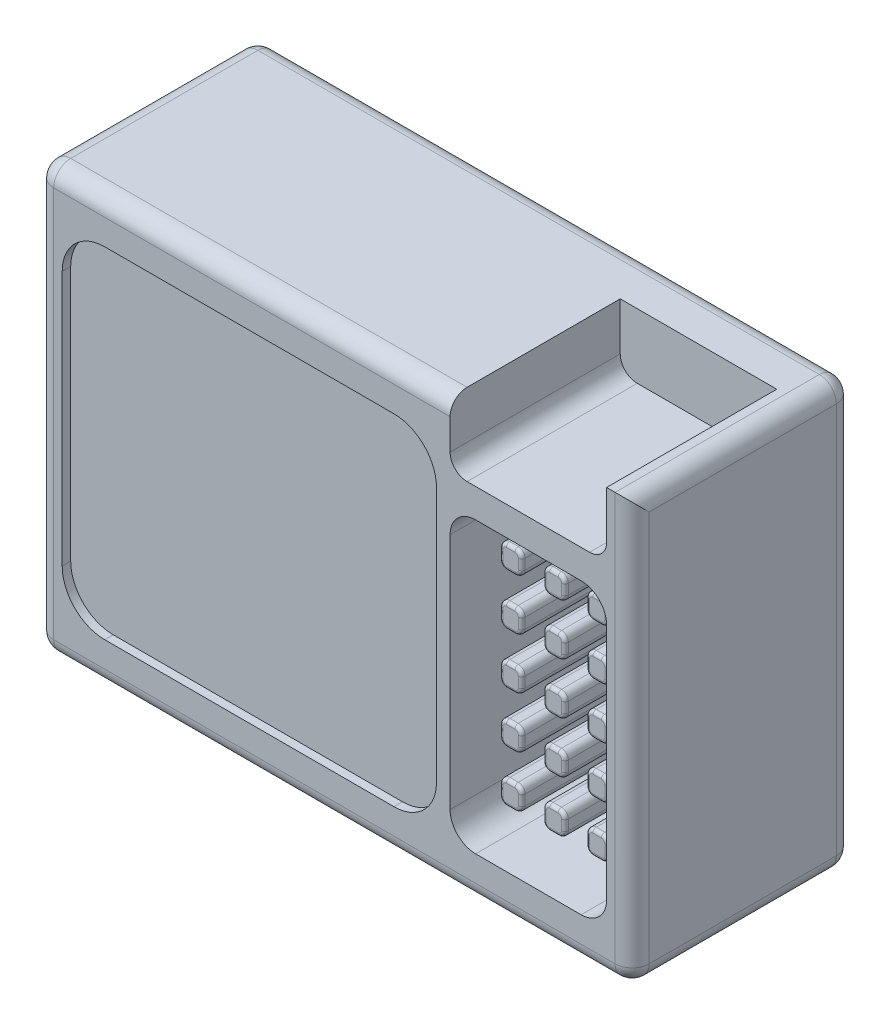
from build123d import *

# Parameters (mm, degrees)
SKETCH1_W           = 35
SKETCH1_H           = 25
BOSS_EXTRUDE1_DEPTH = 13
CUT_EXTRUDE1_DEPTH  = 0.5
CUT_EXTRUDE2_DEPTH  = 10
CUT_EXTRUDE3_DEPTH  = 1.5
FILLET1_R           = 1
FILLET3_R           = 0.2


with BuildPart() as part:
    # Sketch1 → Boss-Extrude1 (new body)
    with BuildSketch(Plane.XY):
        Rectangle(SKETCH1_W, SKETCH1_H)
    extrude(amount=BOSS_EXTRUDE1_DEPTH)

    # Sketch2 → Cut-Extrude1 (cut)
    with BuildSketch(Plane.XY.offset(13)):
        with BuildLine():
            Line((-13.5, 10), (3.5, 10))
            ThreePointArc((3.5, 10), (5.267766953, 9.267766953), (6, 7.5))
            Line((6, 7.5), (6, -7.5))
            ThreePointArc((6, -7.5), (5.267766953, -9.267766953), (3.5, -10))
            Line((3.5, -10), (-13.5, -10))
            ThreePointArc((-13.5, -10), (-15.267766953, -9.267766953), (-16, -7.5))
            Line((-16, -7.5), (-16, 7.5))
            ThreePointArc((-16, 7.5), (-15.267766953, 9.267766953), (-13.5, 10))
        make_face()
    extrude(amount=-CUT_EXTRUDE1_DEPTH, mode=Mode.SUBTRACT)

    # Sketch2<4> → Cut-Extrude2 (cut)
    # profile 1 of 2: a face of its own
    with BuildSketch(Plane.XY.offset(13)):
        with BuildLine():
            Line((16, 12.5), (6.8, 12.5))
            Line((6.8, 12.5), (6.8, 9.7))
            ThreePointArc((6.8, 9.7), (7.092893219, 8.992893219), (7.8, 8.7))
            Line((7.8, 8.7), (15, 8.7))
            ThreePointArc((15, 8.7), (15.707106781, 8.992893219), (16, 9.7))
            Line((16, 9.7), (16, 12.5))
        make_face()
    # profile 2 of 2: a face of its own
    with BuildSketch(Plane.XY.offset(13)):
        with BuildLine():
            ThreePointArc((8.3, 7), (7.239339828, 6.560660172), (6.8, 5.5))
            Line((6.8, 5.5), (6.8, -8.5))
            ThreePointArc((6.8, -8.5), (7.239339828, -9.560660172), (8.3, -10))
            Line((8.3, -10), (14.5, -10))
            ThreePointArc((14.5, -10), (15.560660172, -9.560660172), (16, -8.5))
            Line((16, -8.5), (16, 5.5))
            ThreePointArc((16, 5.5), (15.560660172, 6.560660172), (14.5, 7))
            Line((14.5, 7), (8.3, 7))
        make_face()
        with BuildLine():
            Line((8.21, -7.8), (8.21, -7.2))
            ThreePointArc((8.21, -7.2), (8.327157288, -6.917157288), (8.61, -6.8))
            Line((8.61, -6.8), (9.11, -6.8))
            ThreePointArc((9.11, -6.8), (9.392842712, -6.917157288), (9.51, -7.2))
            Line((9.51, -7.2), (9.51, -7.8))
            ThreePointArc((9.51, -7.8), (9.392842712, -8.082842712), (9.11, -8.2))
            Line((9.11, -8.2), (8.61, -8.2))
            ThreePointArc((8.61, -8.2), (8.327157288, -8.082842712), (8.21, -7.8))
        make_face(mode=Mode.SUBTRACT)
        with BuildLine():
            Line((10.75, -7.8), (10.75, -7.2))
            ThreePointArc((10.75, -7.2), (10.867157288, -6.917157288), (11.15, -6.8))
            Line((11.15, -6.8), (11.65, -6.8))
            ThreePointArc((11.65, -6.8), (11.932842712, -6.917157288), (12.05, -7.2))
            Line((12.05, -7.2), (12.05, -7.8))
            ThreePointArc((12.05, -7.8), (11.932842712, -8.082842712), (11.65, -8.2))
            Line((11.65, -8.2), (11.15, -8.2))
            ThreePointArc((11.15, -8.2), (10.867157288, -8.082842712), (10.75, -7.8))
        make_face(mode=Mode.SUBTRACT)
        with BuildLine():
            Line((13.29, -7.8), (13.29, -7.2))
            ThreePointArc((13.29, -7.2), (13.407157288, -6.917157288), (13.69, -6.8))
            Line((13.69, -6.8), (14.19, -6.8))
            ThreePointArc((14.19, -6.8), (14.472842712, -6.917157288), (14.59, -7.2))
            Line((14.59, -7.2), (14.59, -7.8))
            ThreePointArc((14.59, -7.8), (14.472842712, -8.082842712), (14.19, -8.2))
            Line((14.19, -8.2), (13.69, -8.2))
            ThreePointArc((13.69, -8.2), (13.407157288, -8.082842712), (13.29, -7.8))
        make_face(mode=Mode.SUBTRACT)
        with BuildLine():
            Line((8.21, -4.8), (8.21, -4.2))
            ThreePointArc((8.21, -4.2), (8.327157288, -3.917157288), (8.61, -3.8))
            Line((8.61, -3.8), (9.11, -3.8))
            ThreePointArc((9.11, -3.8), (9.392842712, -3.917157288), (9.51, -4.2))
            Line((9.51, -4.2), (9.51, -4.8))
            ThreePointArc((9.51, -4.8), (9.392842712, -5.082842712), (9.11, -5.2))
            Line((9.11, -5.2), (8.61, -5.2))
            ThreePointArc((8.61, -5.2), (8.327157288, -5.082842712), (8.21, -4.8))
        make_face(mode=Mode.SUBTRACT)
        with BuildLine():
            Line((10.75, -4.8), (10.75, -4.2))
            ThreePointArc((10.75, -4.2), (10.867157288, -3.917157288), (11.15, -3.8))
            Line((11.15, -3.8), (11.65, -3.8))
            ThreePointArc((11.65, -3.8), (11.932842712, -3.917157288), (12.05, -4.2))
            Line((12.05, -4.2), (12.05, -4.8))
            ThreePointArc((12.05, -4.8), (11.932842712, -5.082842712), (11.65, -5.2))
            Line((11.65, -5.2), (11.15, -5.2))
            ThreePointArc((11.15, -5.2), (10.867157288, -5.082842712), (10.75, -4.8))
        make_face(mode=Mode.SUBTRACT)
        with BuildLine():
            Line((13.29, -4.8), (13.29, -4.2))
            ThreePointArc((13.29, -4.2), (13.407157288, -3.917157288), (13.69, -3.8))
            Line((13.69, -3.8), (14.19, -3.8))
            ThreePointArc((14.19, -3.8), (14.472842712, -3.917157288), (14.59, -4.2))
            Line((14.59, -4.2), (14.59, -4.8))
            ThreePointArc((14.59, -4.8), (14.472842712, -5.082842712), (14.19, -5.2))
            Line((14.19, -5.2), (13.69, -5.2))
            ThreePointArc((13.69, -5.2), (13.407157288, -5.082842712), (13.29, -4.8))
        make_face(mode=Mode.SUBTRACT)
        with BuildLine():
            Line((8.21, -1.8), (8.21, -1.2))
            ThreePointArc((8.21, -1.2), (8.327157288, -0.917157288), (8.61, -0.8))
            Line((8.61, -0.8), (9.11, -0.8))
            ThreePointArc((9.11, -0.8), (9.392842712, -0.917157288), (9.51, -1.2))
            Line((9.51, -1.2), (9.51, -1.8))
            ThreePointArc((9.51, -1.8), (9.392842712, -2.082842712), (9.11, -2.2))
            Line((9.11, -2.2), (8.61, -2.2))
            ThreePointArc((8.61, -2.2), (8.327157288, -2.082842712), (8.21, -1.8))
        make_face(mode=Mode.SUBTRACT)
        with BuildLine():
            Line((10.75, -1.8), (10.75, -1.2))
            ThreePointArc((10.75, -1.2), (10.867157288, -0.917157288), (11.15, -0.8))
            Line((11.15, -0.8), (11.65, -0.8))
            ThreePointArc((11.65, -0.8), (11.932842712, -0.917157288), (12.05, -1.2))
            Line((12.05, -1.2), (12.05, -1.8))
            ThreePointArc((12.05, -1.8), (11.932842712, -2.082842712), (11.65, -2.2))
            Line((11.65, -2.2), (11.15, -2.2))
            ThreePointArc((11.15, -2.2), (10.867157288, -2.082842712), (10.75, -1.8))
        make_face(mode=Mode.SUBTRACT)
        with BuildLine():
            Line((13.29, -1.8), (13.29, -1.2))
            ThreePointArc((13.29, -1.2), (13.407157288, -0.917157288), (13.69, -0.8))
            Line((13.69, -0.8), (14.19, -0.8))
            ThreePointArc((14.19, -0.8), (14.472842712, -0.917157288), (14.59, -1.2))
            Line((14.59, -1.2), (14.59, -1.8))
            ThreePointArc((14.59, -1.8), (14.472842712, -2.082842712), (14.19, -2.2))
            Line((14.19, -2.2), (13.69, -2.2))
            ThreePointArc((13.69, -2.2), (13.407157288, -2.082842712), (13.29, -1.8))
        make_face(mode=Mode.SUBTRACT)
        with BuildLine():
            Line((8.21, 1.2), (8.21, 1.8))
            ThreePointArc((8.21, 1.8), (8.327157288, 2.082842712), (8.61, 2.2))
            Line((8.61, 2.2), (9.11, 2.2))
            ThreePointArc((9.11, 2.2), (9.392842712, 2.082842712), (9.51, 1.8))
            Line((9.51, 1.8), (9.51, 1.2))
            ThreePointArc((9.51, 1.2), (9.392842712, 0.917157288), (9.11, 0.8))
            Line((9.11, 0.8), (8.61, 0.8))
            ThreePointArc((8.61, 0.8), (8.327157288, 0.917157288), (8.21, 1.2))
        make_face(mode=Mode.SUBTRACT)
        with BuildLine():
            Line((10.75, 1.2), (10.75, 1.8))
            ThreePointArc((10.75, 1.8), (10.867157288, 2.082842712), (11.15, 2.2))
            Line((11.15, 2.2), (11.65, 2.2))
            ThreePointArc((11.65, 2.2), (11.932842712, 2.082842712), (12.05, 1.8))
            Line((12.05, 1.8), (12.05, 1.2))
            ThreePointArc((12.05, 1.2), (11.932842712, 0.917157288), (11.65, 0.8))
            Line((11.65, 0.8), (11.15, 0.8))
            ThreePointArc((11.15, 0.8), (10.867157288, 0.917157288), (10.75, 1.2))
        make_face(mode=Mode.SUBTRACT)
        with BuildLine():
            Line((13.29, 1.2), (13.29, 1.8))
            ThreePointArc((13.29, 1.8), (13.407157288, 2.082842712), (13.69, 2.2))
            Line((13.69, 2.2), (14.19, 2.2))
            ThreePointArc((14.19, 2.2), (14.472842712, 2.082842712), (14.59, 1.8))
            Line((14.59, 1.8), (14.59, 1.2))
            ThreePointArc((14.59, 1.2), (14.472842712, 0.917157288), (14.19, 0.8))
            Line((14.19, 0.8), (13.69, 0.8))
            ThreePointArc((13.69, 0.8), (13.407157288, 0.917157288), (13.29, 1.2))
        make_face(mode=Mode.SUBTRACT)
        with BuildLine():
            ThreePointArc((8.21, 4.8), (8.327157288, 5.082842712), (8.61, 5.2))
            Line((8.61, 5.2), (9.11, 5.2))
            ThreePointArc((9.11, 5.2), (9.392842712, 5.082842712), (9.51, 4.8))
            Line((9.51, 4.8), (9.51, 4.2))
            ThreePointArc((9.51, 4.2), (9.392842712, 3.917157288), (9.11, 3.8))
            Line((9.11, 3.8), (8.61, 3.8))
            ThreePointArc((8.61, 3.8), (8.327157288, 3.917157288), (8.21, 4.2))
            Line((8.21, 4.2), (8.21, 4.8))
        make_face(mode=Mode.SUBTRACT)
        with BuildLine():
            Line((10.75, 4.2), (10.75, 4.8))
            ThreePointArc((10.75, 4.8), (10.867157288, 5.082842712), (11.15, 5.2))
            Line((11.15, 5.2), (11.65, 5.2))
            ThreePointArc((11.65, 5.2), (11.932842712, 5.082842712), (12.05, 4.8))
            Line((12.05, 4.8), (12.05, 4.2))
            ThreePointArc((12.05, 4.2), (11.932842712, 3.917157288), (11.65, 3.8))
            Line((11.65, 3.8), (11.15, 3.8))
            ThreePointArc((11.15, 3.8), (10.867157288, 3.917157288), (10.75, 4.2))
        make_face(mode=Mode.SUBTRACT)
        with BuildLine():
            Line((13.29, 4.2), (13.29, 4.8))
            ThreePointArc((13.29, 4.8), (13.407157288, 5.082842712), (13.69, 5.2))
            Line((13.69, 5.2), (14.19, 5.2))
            ThreePointArc((14.19, 5.2), (14.472842712, 5.082842712), (14.59, 4.8))
            Line((14.59, 4.8), (14.59, 4.2))
            ThreePointArc((14.59, 4.2), (14.472842712, 3.917157288), (14.19, 3.8))
            Line((14.19, 3.8), (13.69, 3.8))
            ThreePointArc((13.69, 3.8), (13.407157288, 3.917157288), (13.29, 4.2))
        make_face(mode=Mode.SUBTRACT)
    extrude(amount=-CUT_EXTRUDE2_DEPTH, mode=Mode.SUBTRACT)

    # Sketch2<5> → Cut-Extrude3 (cut)
    with BuildSketch(Plane.XY.offset(13)):
        with BuildLine():
            Line((8.61, -8.2), (9.11, -8.2))
            ThreePointArc((9.11, -8.2), (9.392842712, -8.082842712), (9.51, -7.8))
            Line((9.51, -7.8), (9.51, -7.2))
            ThreePointArc((9.51, -7.2), (9.392842712, -6.917157288), (9.11, -6.8))
            Line((9.11, -6.8), (8.61, -6.8))
            ThreePointArc((8.61, -6.8), (8.327157288, -6.917157288), (8.21, -7.2))
            Line((8.21, -7.2), (8.21, -7.8))
            ThreePointArc((8.21, -7.8), (8.327157288, -8.082842712), (8.61, -8.2))
        make_face()
        with BuildLine():
            Line((8.61, -5.2), (9.11, -5.2))
            ThreePointArc((9.11, -5.2), (9.392842712, -5.082842712), (9.51, -4.8))
            Line((9.51, -4.8), (9.51, -4.2))
            ThreePointArc((9.51, -4.2), (9.392842712, -3.917157288), (9.11, -3.8))
            Line((9.11, -3.8), (8.61, -3.8))
            ThreePointArc((8.61, -3.8), (8.327157288, -3.917157288), (8.21, -4.2))
            Line((8.21, -4.2), (8.21, -4.8))
            ThreePointArc((8.21, -4.8), (8.327157288, -5.082842712), (8.61, -5.2))
        make_face()
        with BuildLine():
            Line((11.15, -8.2), (11.65, -8.2))
            ThreePointArc((11.65, -8.2), (11.932842712, -8.082842712), (12.05, -7.8))
            Line((12.05, -7.8), (12.05, -7.2))
            ThreePointArc((12.05, -7.2), (11.932842712, -6.917157288), (11.65, -6.8))
            Line((11.65, -6.8), (11.15, -6.8))
            ThreePointArc((11.15, -6.8), (10.867157288, -6.917157288), (10.75, -7.2))
            Line((10.75, -7.2), (10.75, -7.8))
            ThreePointArc((10.75, -7.8), (10.867157288, -8.082842712), (11.15, -8.2))
        make_face()
        with BuildLine():
            Line((11.15, -5.2), (11.65, -5.2))
            ThreePointArc((11.65, -5.2), (11.932842712, -5.082842712), (12.05, -4.8))
            Line((12.05, -4.8), (12.05, -4.2))
            ThreePointArc((12.05, -4.2), (11.932842712, -3.917157288), (11.65, -3.8))
            Line((11.65, -3.8), (11.15, -3.8))
            ThreePointArc((11.15, -3.8), (10.867157288, -3.917157288), (10.75, -4.2))
            Line((10.75, -4.2), (10.75, -4.8))
            ThreePointArc((10.75, -4.8), (10.867157288, -5.082842712), (11.15, -5.2))
        make_face()
        with BuildLine():
            Line((13.69, -5.2), (14.19, -5.2))
            ThreePointArc((14.19, -5.2), (14.472842712, -5.082842712), (14.59, -4.8))
            Line((14.59, -4.8), (14.59, -4.2))
            ThreePointArc((14.59, -4.2), (14.472842712, -3.917157288), (14.19, -3.8))
            Line((14.19, -3.8), (13.69, -3.8))
            ThreePointArc((13.69, -3.8), (13.407157288, -3.917157288), (13.29, -4.2))
            Line((13.29, -4.2), (13.29, -4.8))
            ThreePointArc((13.29, -4.8), (13.407157288, -5.082842712), (13.69, -5.2))
        make_face()
        with BuildLine():
            Line((13.69, -8.2), (14.19, -8.2))
            ThreePointArc((14.19, -8.2), (14.472842712, -8.082842712), (14.59, -7.8))
            Line((14.59, -7.8), (14.59, -7.2))
            ThreePointArc((14.59, -7.2), (14.472842712, -6.917157288), (14.19, -6.8))
            Line((14.19, -6.8), (13.69, -6.8))
            ThreePointArc((13.69, -6.8), (13.407157288, -6.917157288), (13.29, -7.2))
            Line((13.29, -7.2), (13.29, -7.8))
            ThreePointArc((13.29, -7.8), (13.407157288, -8.082842712), (13.69, -8.2))
        make_face()
        with BuildLine():
            Line((13.69, -2.2), (14.19, -2.2))
            ThreePointArc((14.19, -2.2), (14.472842712, -2.082842712), (14.59, -1.8))
            Line((14.59, -1.8), (14.59, -1.2))
            ThreePointArc((14.59, -1.2), (14.472842712, -0.917157288), (14.19, -0.8))
            Line((14.19, -0.8), (13.69, -0.8))
            ThreePointArc((13.69, -0.8), (13.407157288, -0.917157288), (13.29, -1.2))
            Line((13.29, -1.2), (13.29, -1.8))
            ThreePointArc((13.29, -1.8), (13.407157288, -2.082842712), (13.69, -2.2))
        make_face()
        with BuildLine():
            Line((11.15, -2.2), (11.65, -2.2))
            ThreePointArc((11.65, -2.2), (11.932842712, -2.082842712), (12.05, -1.8))
            Line((12.05, -1.8), (12.05, -1.2))
            ThreePointArc((12.05, -1.2), (11.932842712, -0.917157288), (11.65, -0.8))
            Line((11.65, -0.8), (11.15, -0.8))
            ThreePointArc((11.15, -0.8), (10.867157288, -0.917157288), (10.75, -1.2))
            Line((10.75, -1.2), (10.75, -1.8))
            ThreePointArc((10.75, -1.8), (10.867157288, -2.082842712), (11.15, -2.2))
        make_face()
        with BuildLine():
            Line((8.61, -2.2), (9.11, -2.2))
            ThreePointArc((9.11, -2.2), (9.392842712, -2.082842712), (9.51, -1.8))
            Line((9.51, -1.8), (9.51, -1.2))
            ThreePointArc((9.51, -1.2), (9.392842712, -0.917157288), (9.11, -0.8))
            Line((9.11, -0.8), (8.61, -0.8))
            ThreePointArc((8.61, -0.8), (8.327157288, -0.917157288), (8.21, -1.2))
            Line((8.21, -1.2), (8.21, -1.8))
            ThreePointArc((8.21, -1.8), (8.327157288, -2.082842712), (8.61, -2.2))
        make_face()
        with BuildLine():
            Line((8.61, 0.8), (9.11, 0.8))
            ThreePointArc((9.11, 0.8), (9.392842712, 0.917157288), (9.51, 1.2))
            Line((9.51, 1.2), (9.51, 1.8))
            ThreePointArc((9.51, 1.8), (9.392842712, 2.082842712), (9.11, 2.2))
            Line((9.11, 2.2), (8.61, 2.2))
            ThreePointArc((8.61, 2.2), (8.327157288, 2.082842712), (8.21, 1.8))
            Line((8.21, 1.8), (8.21, 1.2))
            ThreePointArc((8.21, 1.2), (8.327157288, 0.917157288), (8.61, 0.8))
        make_face()
        with BuildLine():
            Line((11.15, 0.8), (11.65, 0.8))
            ThreePointArc((11.65, 0.8), (11.932842712, 0.917157288), (12.05, 1.2))
            Line((12.05, 1.2), (12.05, 1.8))
            ThreePointArc((12.05, 1.8), (11.932842712, 2.082842712), (11.65, 2.2))
            Line((11.65, 2.2), (11.15, 2.2))
            ThreePointArc((11.15, 2.2), (10.867157288, 2.082842712), (10.75, 1.8))
            Line((10.75, 1.8), (10.75, 1.2))
            ThreePointArc((10.75, 1.2), (10.867157288, 0.917157288), (11.15, 0.8))
        make_face()
        with BuildLine():
            Line((13.69, 0.8), (14.19, 0.8))
            ThreePointArc((14.19, 0.8), (14.472842712, 0.917157288), (14.59, 1.2))
            Line((14.59, 1.2), (14.59, 1.8))
            ThreePointArc((14.59, 1.8), (14.472842712, 2.082842712), (14.19, 2.2))
            Line((14.19, 2.2), (13.69, 2.2))
            ThreePointArc((13.69, 2.2), (13.407157288, 2.082842712), (13.29, 1.8))
            Line((13.29, 1.8), (13.29, 1.2))
            ThreePointArc((13.29, 1.2), (13.407157288, 0.917157288), (13.69, 0.8))
        make_face()
        with BuildLine():
            Line((11.15, 3.8), (11.65, 3.8))
            ThreePointArc((11.65, 3.8), (11.932842712, 3.917157288), (12.05, 4.2))
            Line((12.05, 4.2), (12.05, 4.8))
            ThreePointArc((12.05, 4.8), (11.932842712, 5.082842712), (11.65, 5.2))
            Line((11.65, 5.2), (11.15, 5.2))
            ThreePointArc((11.15, 5.2), (10.867157288, 5.082842712), (10.75, 4.8))
            Line((10.75, 4.8), (10.75, 4.2))
            ThreePointArc((10.75, 4.2), (10.867157288, 3.917157288), (11.15, 3.8))
        make_face()
        with BuildLine():
            Line((13.69, 3.8), (14.19, 3.8))
            ThreePointArc((14.19, 3.8), (14.472842712, 3.917157288), (14.59, 4.2))
            Line((14.59, 4.2), (14.59, 4.8))
            ThreePointArc((14.59, 4.8), (14.472842712, 5.082842712), (14.19, 5.2))
            Line((14.19, 5.2), (13.69, 5.2))
            ThreePointArc((13.69, 5.2), (13.407157288, 5.082842712), (13.29, 4.8))
            Line((13.29, 4.8), (13.29, 4.2))
            ThreePointArc((13.29, 4.2), (13.407157288, 3.917157288), (13.69, 3.8))
        make_face()
        with BuildLine():
            Line((8.61, 5.2), (9.11, 5.2))
            ThreePointArc((9.11, 5.2), (9.392842712, 5.082842712), (9.51, 4.8))
            Line((9.51, 4.8), (9.51, 4.2))
            ThreePointArc((9.51, 4.2), (9.392842712, 3.917157288), (9.11, 3.8))
            Line((9.11, 3.8), (8.61, 3.8))
            ThreePointArc((8.61, 3.8), (8.327157288, 3.917157288), (8.21, 4.2))
            Line((8.21, 4.2), (8.21, 4.8))
            ThreePointArc((8.21, 4.8), (8.327157288, 5.082842712), (8.61, 5.2))
        make_face()
    extrude(amount=-CUT_EXTRUDE3_DEPTH, mode=Mode.SUBTRACT)

    # Fillet1
    fillet1_edges = [part.edges().sort_by_distance(p)[0] for p in [
        (17.5, -12.5, 6.5),
        (17.5, 0, 13),
        (17.5, 12.5, 6.5),
        (17.5, 0, 0),
        (-17.5, 12.5, 6.5),
        (-17.5, 0, 13),
        (-17.5, -12.5, 6.5),
        (-17.5, 0, 0),
        (0, -12.5, 0),
        (-5.35, 12.5, 13),
        (0, 12.5, 0),
        (0, -12.5, 13),
    ]]
    fillet(fillet1_edges, radius=FILLET1_R)

    # Fillet3
    fillet3_edges = [part.edges().sort_by_distance(p)[0] for p in [
        (11.4, 3.8, 11.5),
        (10.867157288, 3.917157288, 11.5),
        (10.75, 4.5, 11.5),
        (10.867157288, 5.082842712, 11.5),
        (11.932842712, 3.917157288, 11.5),
        (11.4, 5.2, 11.5),
        (11.932842712, 5.082842712, 11.5),
        (12.05, 4.5, 11.5),
        (13.94, 0.8, 11.5),
        (13.407157288, 0.917157288, 11.5),
        (13.29, 1.5, 11.5),
        (13.407157288, 2.082842712, 11.5),
        (14.472842712, 0.917157288, 11.5),
        (13.94, 2.2, 11.5),
        (14.472842712, 2.082842712, 11.5),
        (14.59, 1.5, 11.5),
        (11.4, 0.8, 11.5),
        (10.867157288, 0.917157288, 11.5),
        (10.75, 1.5, 11.5),
        (10.867157288, 2.082842712, 11.5),
        (11.932842712, 0.917157288, 11.5),
        (11.4, 2.2, 11.5),
        (11.932842712, 2.082842712, 11.5),
        (12.05, 1.5, 11.5),
        (8.86, 0.8, 11.5),
        (8.327157288, 0.917157288, 11.5),
        (8.21, 1.5, 11.5),
        (8.327157288, 2.082842712, 11.5),
        (9.392842712, 0.917157288, 11.5),
        (8.86, 2.2, 11.5),
        (9.392842712, 2.082842712, 11.5),
        (9.51, 1.5, 11.5),
        (13.94, 3.8, 11.5),
        (13.407157288, 3.917157288, 11.5),
        (13.29, 4.5, 11.5),
        (13.407157288, 5.082842712, 11.5),
        (14.472842712, 3.917157288, 11.5),
        (13.94, 5.2, 11.5),
        (14.472842712, 5.082842712, 11.5),
        (14.59, 4.5, 11.5),
        (9.392842712, 3.917157288, 11.5),
        (8.86, 3.8, 11.5),
        (8.327157288, 3.917157288, 11.5),
        (8.21, 4.5, 11.5),
        (8.327157288, 5.082842712, 11.5),
        (8.86, 5.2, 11.5),
        (9.392842712, 5.082842712, 11.5),
        (9.51, 4.5, 11.5),
        (13.94, -5.2, 11.5),
        (13.407157288, -5.082842712, 11.5),
        (13.29, -4.5, 11.5),
        (13.407157288, -3.917157288, 11.5),
        (14.472842712, -5.082842712, 11.5),
        (13.94, -3.8, 11.5),
        (14.472842712, -3.917157288, 11.5),
        (14.59, -4.5, 11.5),
        (11.4, -5.2, 11.5),
        (10.867157288, -5.082842712, 11.5),
        (10.75, -4.5, 11.5),
        (10.867157288, -3.917157288, 11.5),
        (11.932842712, -5.082842712, 11.5),
        (11.4, -3.8, 11.5),
        (11.932842712, -3.917157288, 11.5),
        (12.05, -4.5, 11.5),
        (11.4, -8.2, 11.5),
        (10.867157288, -8.082842712, 11.5),
        (10.75, -7.5, 11.5),
        (10.867157288, -6.917157288, 11.5),
        (11.932842712, -8.082842712, 11.5),
        (11.4, -6.8, 11.5),
        (11.932842712, -6.917157288, 11.5),
        (12.05, -7.5, 11.5),
        (8.86, -5.2, 11.5),
        (8.327157288, -5.082842712, 11.5),
        (8.21, -4.5, 11.5),
        (8.327157288, -3.917157288, 11.5),
        (9.392842712, -5.082842712, 11.5),
        (8.86, -3.8, 11.5),
        (9.392842712, -3.917157288, 11.5),
        (9.51, -4.5, 11.5),
        (13.94, -8.2, 11.5),
        (13.407157288, -8.082842712, 11.5),
        (13.29, -7.5, 11.5),
        (13.407157288, -6.917157288, 11.5),
        (14.472842712, -8.082842712, 11.5),
        (13.94, -6.8, 11.5),
        (14.472842712, -6.917157288, 11.5),
        (14.59, -7.5, 11.5),
        (13.94, -2.2, 11.5),
        (13.407157288, -2.082842712, 11.5),
        (13.29, -1.5, 11.5),
        (13.407157288, -0.917157288, 11.5),
        (14.472842712, -2.082842712, 11.5),
        (13.94, -0.8, 11.5),
        (14.472842712, -0.917157288, 11.5),
        (14.59, -1.5, 11.5),
        (11.4, -2.2, 11.5),
        (10.867157288, -2.082842712, 11.5),
        (10.75, -1.5, 11.5),
        (10.867157288, -0.917157288, 11.5),
        (11.932842712, -2.082842712, 11.5),
        (11.4, -0.8, 11.5),
        (11.932842712, -0.917157288, 11.5),
        (12.05, -1.5, 11.5),
        (8.86, -2.2, 11.5),
        (8.327157288, -2.082842712, 11.5),
        (8.21, -1.5, 11.5),
        (8.327157288, -0.917157288, 11.5),
        (9.392842712, -2.082842712, 11.5),
        (8.86, -0.8, 11.5),
        (9.392842712, -0.917157288, 11.5),
        (9.51, -1.5, 11.5),
        (8.86, -8.2, 11.5),
        (8.327157288, -8.082842712, 11.5),
        (8.21, -7.5, 11.5),
        (8.327157288, -6.917157288, 11.5),
        (9.392842712, -8.082842712, 11.5),
        (8.86, -6.8, 11.5),
        (9.392842712, -6.917157288, 11.5),
        (9.51, -7.5, 11.5),
    ]]
    fillet(fillet3_edges, radius=FILLET3_R)


solid = part.part
